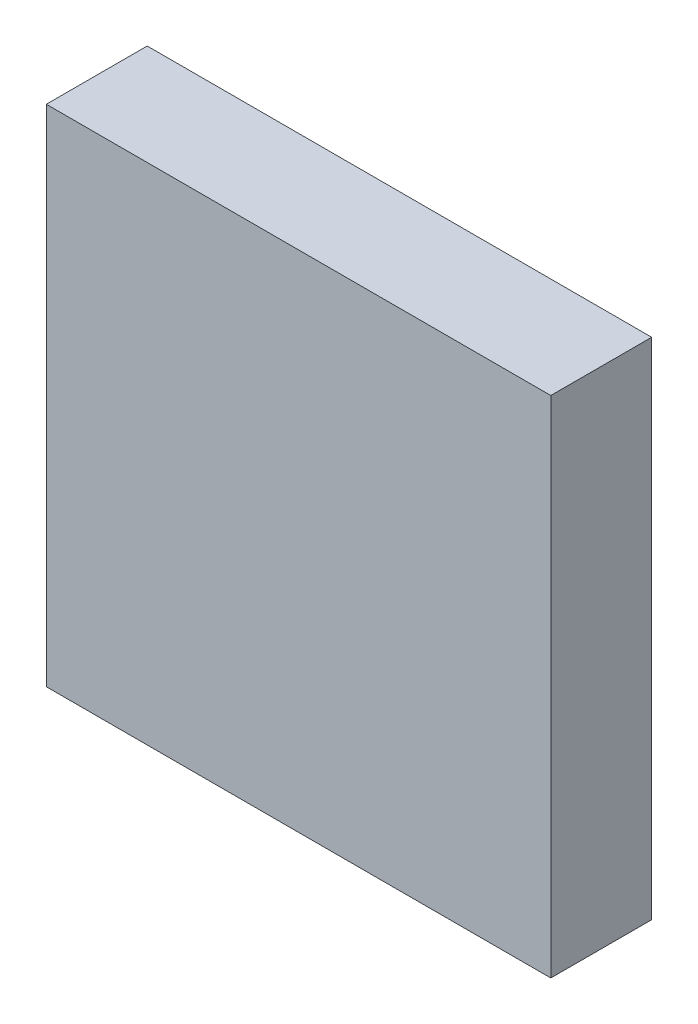
from build123d import *

# Parameters (mm, degrees)
SKETCH_1_W      = 20
SKETCH_1_H      = 20
EXTRUDE_1_DEPTH = 4


with BuildPart() as part:
    # Эскиз1 → Бобышка-Вытянуть1 (new body)
    with BuildSketch(Plane.XY):
        with Locations((10, 10)):
            Rectangle(SKETCH_1_W, SKETCH_1_H)
    extrude(amount=EXTRUDE_1_DEPTH)


solid = part.part
